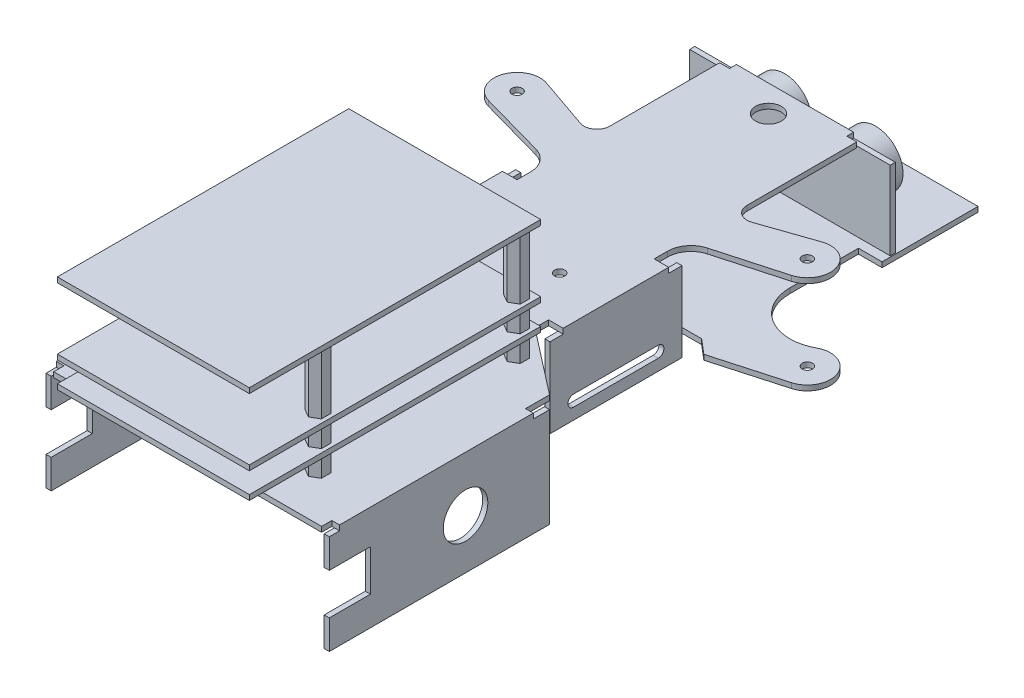
from build123d import *

# Parameters (mm, degrees)
SKETCH2_W            = 2.25
SKETCH2_H            = 56.5
SKETCH2_W_2          = 4.25
SKETCH2_H_2          = 30.8
SKETCH2_R            = 6.75
SKETCH2_W_3          = 34.2
SKETCH2_H_3          = 2
BOSS_EXTRUDE1_DEPTH  = 1.5
SKETCH4_W            = 1.5
SKETCH4_H            = 64.25
BOSS_EXTRUDE2_DEPTH  = 29
SKETCH5_R            = 6.5
SKETCH5_W            = 12
SKETCH5_H            = 12
CUT_EXTRUDE1_DEPTH   = 1.5
SKETCH6_W            = 1.5
SKETCH6_H            = 38.5
BOSS_EXTRUDE3_DEPTH  = 23.25
CUT_EXTRUDE2_DEPTH   = 1.5
SKETCH8_W            = 58.5
SKETCH8_H            = 1.5
BOSS_EXTRUDE4_DEPTH  = 22.9
SKETCH9_R            = 7.95
BOSS_EXTRUDE5_DEPTH  = 10.25
SKETCH11_W           = 53.75
SKETCH11_H           = 28
SKETCH11_R           = 6.75
BOSS_EXTRUDE6_DEPTH  = 1.5
SKETCH12_R           = 1.375
SKETCH12_R_2         = 1.5
CUT_EXTRUDE3_DEPTH   = 180.984061794
BOSS_EXTRUDE7_DEPTH  = 6
SKETCH14_W           = 56
SKETCH14_H           = 85
BOSS_EXTRUDE8_DEPTH  = 1.5
LPATTERN1_COUNT      = 2
LPATTERN1_PITCH      = 7.5
LPATTERN2_COUNT      = 2
LPATTERN2_PITCH      = 7.5
BOSS_EXTRUDE10_DEPTH = 18
LPATTERN3_COUNT      = 2
LPATTERN3_PITCH      = 27
SKETCH17_R           = 3.75
CUT_EXTRUDE4_DEPTH   = 1.5


with BuildPart() as part:
    # Sketch2 → Boss-Extrude1 (new body)
    with BuildSketch(Plane(origin=(0, 0, 0), x_dir=(1, 0, 0), z_dir=(0, 1, 0))):
        Polygon((-17.1, 141.95), (-20, 141.95), (-20, 109.913160678), (-20, 104.623459002), (-20, 91.954593175), (-20, 86.763527754), (-20, 82.85), (-20, 52.05), (-20, 48.05), (-39.075, 33.25), (-39.075, 26.25), (-39.075, -30.25), (-39.075, -33.25), (39.075, -33.25), (39.075, -30.25), (39.075, 26.25), (39.075, 33.25), (20, 48.05), (20, 52.05), (20, 82.85), (20, 86.763527754), (20, 91.954593175), (20, 104.623459002), (20, 109.913160678), (20, 141.95), (17.1, 141.95), align=None)
        with Locations((-40.2, -2)):
            Rectangle(SKETCH2_W, SKETCH2_H)
        with Locations((-22.125, 67.45)):
            Rectangle(SKETCH2_W_2, SKETCH2_H_2)
        with Locations((22.125, 67.45)):
            Rectangle(SKETCH2_W_2, SKETCH2_H_2)
        with BuildLine():
            Line((25, 106.35), (20, 104.623459002))
            Line((20, 104.623459002), (20, 91.954593175))
            Line((20, 91.954593175), (25, 93.35))
            Line((25, 93.35), (44.164462986, 98.698444488))
            ThreePointArc((44.164462986, 98.698444488), (35.906129515, 103.190265399), (40.146822496, 111.580322005))
            Line((40.146822496, 111.580322005), (25, 106.35))
        make_face()
        with BuildLine():
            ThreePointArc((25, 106.35), (21.581931897, 106.843302619), (20, 109.913160678))
            Line((20, 109.913160678), (20, 104.623459002))
            Line((20, 104.623459002), (25, 106.35))
        make_face()
        with BuildLine():
            Line((25, 93.35), (20, 91.954593175))
            Line((20, 91.954593175), (20, 86.763527754))
            ThreePointArc((20, 86.763527754), (21.391598456, 90.898186647), (25, 93.35))
        make_face()
        with BuildLine():
            Line((-20, 91.954593175), (-20, 104.623459002))
            Line((-20, 104.623459002), (-25, 106.35))
            Line((-25, 106.35), (-40.146822496, 111.580322005))
            ThreePointArc((-40.146822496, 111.580322005), (-36.853003177, 109.117336585), (-35.6, 105.2))
            ThreePointArc((-35.6, 105.2), (-38.268647599, 99.823657137), (-44.164462986, 98.698444488))
            Line((-44.164462986, 98.698444488), (-25, 93.35))
            Line((-25, 93.35), (-20, 91.954593175))
        make_face()
        with Locations((-42.35, 105.2)):
            Circle(SKETCH2_R)
        with BuildLine():
            Line((-20, 104.623459002), (-20, 109.913160678))
            ThreePointArc((-20, 109.913160678), (-21.581931897, 106.843302619), (-25, 106.35))
            Line((-25, 106.35), (-20, 104.623459002))
        make_face()
        with BuildLine():
            Line((-20, 86.763527754), (-20, 91.954593175))
            Line((-20, 91.954593175), (-25, 93.35))
            ThreePointArc((-25, 93.35), (-21.391598456, 90.898186647), (-20, 86.763527754))
        make_face()
        with Locations((0, 142.95)):
            Rectangle(SKETCH2_W_3, SKETCH2_H_3)
        with Locations((40.2, -2)):
            Rectangle(SKETCH2_W, SKETCH2_H)
        with Locations((42.35, 105.2)):
            Circle(SKETCH2_R)
    extrude(amount=BOSS_EXTRUDE1_DEPTH)

    # Sketch4 → Boss-Extrude2 (add)
    with BuildSketch(Plane.XZ):
        with Locations((40.575, 1.125)):
            Rectangle(SKETCH4_W, SKETCH4_H)
    boss_extrude2 = extrude(amount=BOSS_EXTRUDE2_DEPTH)

    # Sketch5 → Cut-Extrude1 (cut)
    with BuildSketch(Plane(origin=(41.325, 0, 0), x_dir=(0, 0, -1), z_dir=(1, 0, 0))):
        with Locations((6.5, -14.5)):
            Circle(SKETCH5_R)
        with Locations((-27.25, -14.5)):
            Rectangle(SKETCH5_W, SKETCH5_H)
    cut_extrude1 = extrude(amount=-CUT_EXTRUDE1_DEPTH, mode=Mode.SUBTRACT)

    # Mirror1: Boss-Extrude2, Cut-Extrude1 across plane
    add(boss_extrude2.mirror(Plane(origin=(0, 0, 0), x_dir=(0, 0, 1), z_dir=(1, 0, 0))))
    add(cut_extrude1.mirror(Plane(origin=(0, 0, 0), x_dir=(0, 0, 1), z_dir=(1, 0, 0))), mode=Mode.SUBTRACT)

    # Sketch6 → Boss-Extrude3 (add)
    with BuildSketch(Plane.XZ):
        with Locations((-23.5, -67.45)):
            Rectangle(SKETCH6_W, SKETCH6_H)
    boss_extrude3 = extrude(amount=BOSS_EXTRUDE3_DEPTH)

    # Sketch7 → Cut-Extrude2 (cut)
    with BuildSketch(Plane.ZY.offset(24.25)):
        with BuildLine():
            Line((-79.8, -16.65), (-55.1, -16.65))
            ThreePointArc((-55.1, -16.65), (-53.45, -18.3), (-55.1, -19.95))
            Line((-55.1, -19.95), (-79.8, -19.95))
            ThreePointArc((-79.8, -19.95), (-81.45, -18.3), (-79.8, -16.65))
        make_face()
    cut_extrude2 = extrude(amount=-CUT_EXTRUDE2_DEPTH, mode=Mode.SUBTRACT)

    # Mirror2: Boss-Extrude3, Cut-Extrude2 across plane
    add(boss_extrude3.mirror(Plane(origin=(0, 0, 0), x_dir=(0, 0, 1), z_dir=(1, 0, 0))))
    add(cut_extrude2.mirror(Plane(origin=(0, 0, 0), x_dir=(0, 0, 1), z_dir=(1, 0, 0))), mode=Mode.SUBTRACT)

    # Sketch8 → Boss-Extrude4 (add)
    with BuildSketch(Plane.XZ):
        with Locations((0, -143.2)):
            Rectangle(SKETCH8_W, SKETCH8_H)
    extrude(amount=BOSS_EXTRUDE4_DEPTH)

    # Sketch9 → Boss-Extrude5 (add)
    with BuildSketch(Plane(origin=(0, 0, -143.95), x_dir=(-1, 0, 0), z_dir=(0, 0, -1))):
        with Locations((13.3, -11.95)):
            Circle(SKETCH9_R)
    boss_extrude5 = extrude(amount=BOSS_EXTRUDE5_DEPTH)

    # Mirror3: Boss-Extrude5 across plane
    add(boss_extrude5.mirror(Plane(origin=(0, 0, 0), x_dir=(0, 0, 1), z_dir=(1, 0, 0))))


with BuildPart() as body_2:
    # Sketch11 → Boss-Extrude6 (new body)
    with BuildSketch(Plane(origin=(0, -25.6, 0), x_dir=(-1, 0, 0), z_dir=(0, -1, 0))):
        with Locations((0, 156.45)):
            Rectangle(SKETCH11_W, SKETCH11_H)
        with BuildLine():
            Line((-24.25, 93.092972765), (-20, 96.692972765))
            Line((-20, 96.692972765), (20, 96.692972765))
            Line((20, 96.692972765), (24.25, 93.092972765))
            Line((24.25, 93.092972765), (44.178896741, 98.702489961))
            ThreePointArc((44.178896741, 98.702489961), (36.100443452, 102.649403413), (39.110302589, 111.121727846))
            ThreePointArc((39.110302589, 111.121727846), (26.328233567, 111.342194017), (20, 122.45))
            Line((20, 122.45), (20, 142.45))
            Line((20, 142.45), (-20, 142.45))
            Line((-20, 142.45), (-20, 122.45))
            ThreePointArc((-20, 122.45), (-26.328233567, 111.342194017), (-39.110302589, 111.121727846))
            ThreePointArc((-39.110302589, 111.121727846), (-36.543518384, 108.641986525), (-35.6, 105.2))
            ThreePointArc((-35.6, 105.2), (-38.274619834, 99.819128649), (-44.178896741, 98.702489961))
            Line((-44.178896741, 98.702489961), (-24.25, 93.092972765))
        make_face()
        with Locations((-42.35, 105.2)):
            Circle(SKETCH11_R)
        with Locations((42.35, 105.2)):
            Circle(SKETCH11_R)
    extrude(amount=BOSS_EXTRUDE6_DEPTH)


with BuildPart() as cut_extrude3_tool:
    # Sketch12 → Cut-Extrude3 (new, through all)
    with BuildSketch(Plane(origin=(0, 1.5, 0), x_dir=(1, 0, 0), z_dir=(0, 1, 0))):
        with Locations(Location((-24.5, -19.75, 0), (0, 0, 270))):
            Circle(SKETCH12_R)
        with Locations(Location((24.5, -19.75, 0), (0, 0, 270))):
            Circle(SKETCH12_R)
        with Locations(Location((24.5, 38.25, 0), (0, 0, 270))):
            Circle(SKETCH12_R)
        with Locations(Location((-24.5, 38.25, 0), (0, 0, 270))):
            Circle(SKETCH12_R)
        with Locations(Location((-42.35, 105.2, 0), (0, 0, 90))):
            Circle(SKETCH12_R_2)
        with Locations(Location((42.35, 105.2, 0), (0, 0, 90))):
            Circle(SKETCH12_R_2)
        with Locations(Location((-9.8, 65.490791797, 0), (0, 0, 270))):
            Circle(SKETCH12_R_2)
        with Locations(Location((9.8, 65.490791797, 0), (0, 0, 270))):
            Circle(SKETCH12_R_2)
    extrude(amount=-CUT_EXTRUDE3_DEPTH)


with BuildPart() as part_1:
    add(part.part)

    # Cut-Extrude3: cut by cut_extrude3_tool
    add(cut_extrude3_tool.part, mode=Mode.SUBTRACT)

    # Sketch13 → Boss-Extrude7 (add)
    with BuildSketch(Plane(origin=(0, 1.5, 0), x_dir=(1, 0, 0), z_dir=(0, 1, 0))):
        Polygon((24.5, 41.021281292), (22.1, 39.635640646), (22.1, 36.864359354), (24.5, 35.478718708), (26.9, 36.864359354), (26.9, 39.635640646), align=None)
        Polygon((-24.5, 41.021281292), (-26.9, 39.635640646), (-26.9, 36.864359354), (-24.5, 35.478718708), (-22.1, 36.864359354), (-22.1, 39.635640646), align=None)
        Polygon((24.5, -16.978718708), (22.1, -18.364359354), (22.1, -21.135640646), (24.5, -22.521281292), (26.9, -21.135640646), (26.9, -18.364359354), align=None)
        Polygon((-24.5, -16.978718708), (-26.9, -18.364359354), (-26.9, -21.135640646), (-24.5, -22.521281292), (-22.1, -21.135640646), (-22.1, -18.364359354), align=None)
    boss_extrude7 = extrude(amount=BOSS_EXTRUDE7_DEPTH)

    # Sketch14 → Boss-Extrude8 (add)
    with BuildSketch(Plane(origin=(0, 7.5, 0), x_dir=(1, 0, 0), z_dir=(0, 1, 0))):
        with Locations((0, -0.75)):
            Rectangle(SKETCH14_W, SKETCH14_H)
    boss_extrude8 = extrude(amount=BOSS_EXTRUDE8_DEPTH)

    # LPattern1: Boss-Extrude7 ×2
    with Locations(*[(0, i * LPATTERN1_PITCH, 0) for i in range(1, LPATTERN1_COUNT)]):
        add(boss_extrude7)

    # LPattern2: Boss-Extrude8 ×2
    with Locations(*[(0, i * LPATTERN2_PITCH, 0) for i in range(1, LPATTERN2_COUNT)]):
        add(boss_extrude8)

    # Sketch16 → Boss-Extrude10 (add)
    with BuildSketch(Plane(origin=(0, 16.5, 0), x_dir=(1, 0, 0), z_dir=(0, 1, 0))):
        Polygon((24.5, 41.021281292), (22.1, 39.635640646), (22.1, 36.864359354), (24.5, 35.478718708), (26.9, 36.864359354), (26.9, 39.635640646), align=None)
        Polygon((-24.5, 41.021281292), (-26.9, 39.635640646), (-26.9, 36.864359354), (-24.5, 35.478718708), (-22.1, 36.864359354), (-22.1, 39.635640646), align=None)
        Polygon((24.5, -16.978718708), (22.1, -18.364359354), (22.1, -21.135640646), (24.5, -22.521281292), (26.9, -21.135640646), (26.9, -18.364359354), align=None)
        Polygon((-24.5, -16.978718708), (-26.9, -18.364359354), (-26.9, -21.135640646), (-24.5, -22.521281292), (-22.1, -21.135640646), (-22.1, -18.364359354), align=None)
    extrude(amount=BOSS_EXTRUDE10_DEPTH)

    # LPattern3: Boss-Extrude8 ×2
    with Locations(*[(0, i * LPATTERN3_PITCH, 0) for i in range(1, LPATTERN3_COUNT)]):
        add(boss_extrude8)

    # Sketch17 → Cut-Extrude4 (cut)
    with BuildSketch(Plane(origin=(0, 1.5, 0), x_dir=(1, 0, 0), z_dir=(0, 1, 0))):
        with Locations(Location((0, 136.2, 0), (0, 0, 270))):
            Circle(SKETCH17_R)
    extrude(amount=-CUT_EXTRUDE4_DEPTH, mode=Mode.SUBTRACT)


with BuildPart() as body_2_1:
    add(body_2.part)

    # Cut-Extrude3: cut by cut_extrude3_tool
    add(cut_extrude3_tool.part, mode=Mode.SUBTRACT)


solid = Compound([part_1.part, body_2_1.part])
